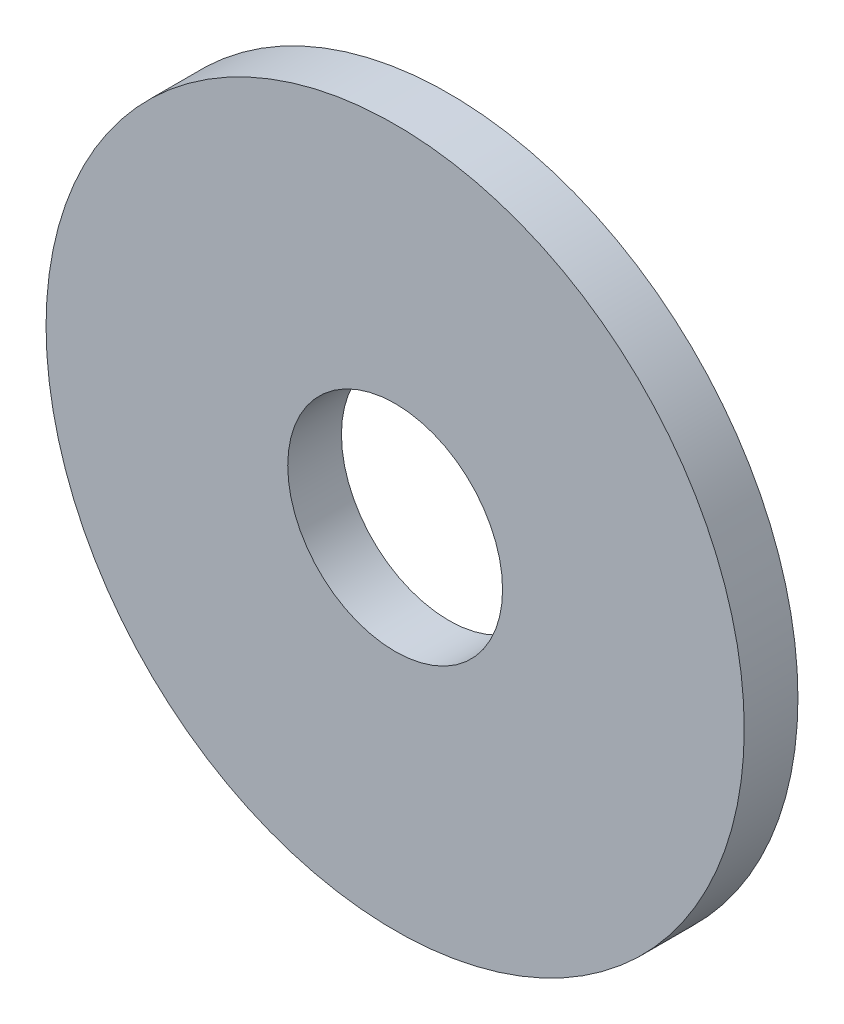
from build123d import *

# Parameters (mm, degrees)
SKETCH_1_R      = 3.25
SKETCH_1_R_2    = 1
EXTRUDE_1_DEPTH = 0.5


with BuildPart() as part:
    # 草图1 → 凸台-拉伸1 (new body)
    with BuildSketch(Plane.XY):
        Circle(SKETCH_1_R)
        Circle(SKETCH_1_R_2, mode=Mode.SUBTRACT)
    extrude(amount=EXTRUDE_1_DEPTH)


solid = part.part
